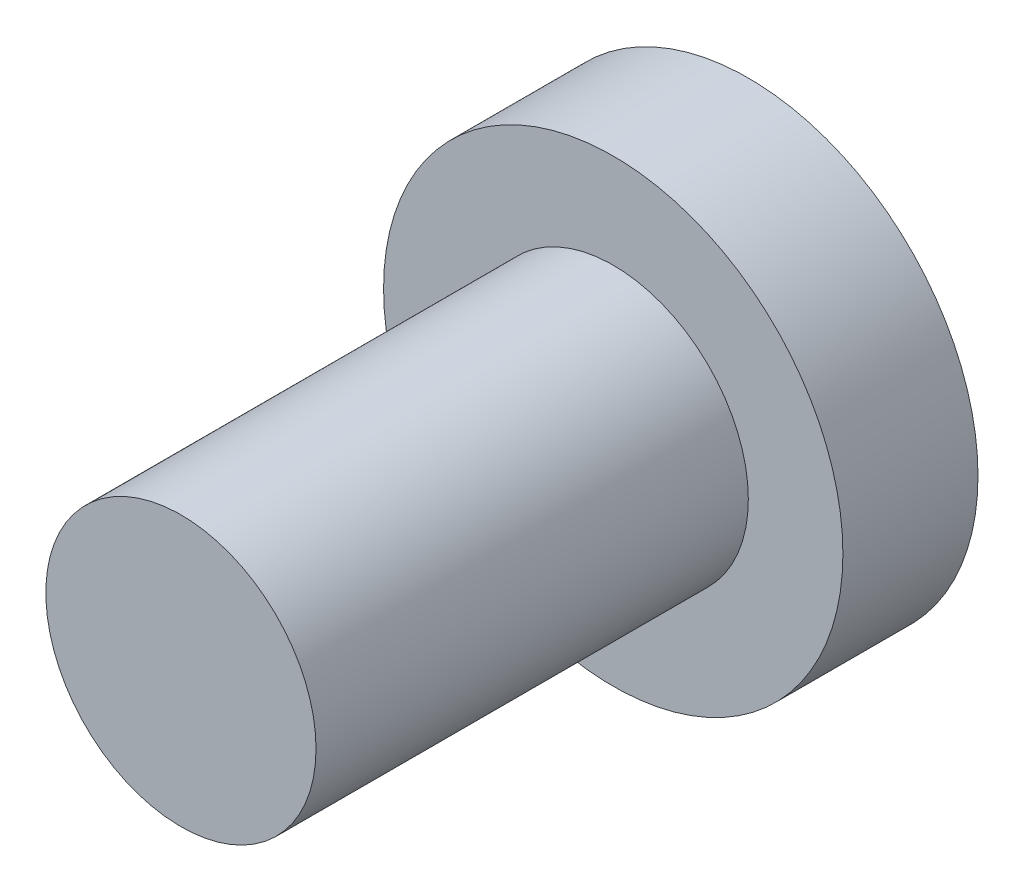
from build123d import *

# Parameters (mm, degrees)
SKETCH1_R           = 4.25
SKETCH1_R_2         = 2.5
BOSS_EXTRUDE3_DEPTH = 2.5
SKETCH1_3_R         = 2.5
BOSS_EXTRUDE4_DEPTH = 8


with BuildPart() as part:
    # Sketch1 → Boss-Extrude3 (new body)
    # profile 1 of 2: a face of its own
    with BuildSketch(Plane.XY):
        Circle(SKETCH1_R)
        Circle(SKETCH1_R_2, mode=Mode.SUBTRACT)
    # profile 2 of 2: a face of its own
    with BuildSketch(Plane.XY):
        Circle(SKETCH1_R_2)
    extrude(amount=-BOSS_EXTRUDE3_DEPTH)

    # Sketch1<3> → Boss-Extrude4 (add)
    with BuildSketch(Plane.XY):
        Circle(SKETCH1_3_R)
    extrude(amount=BOSS_EXTRUDE4_DEPTH)


solid = part.part
